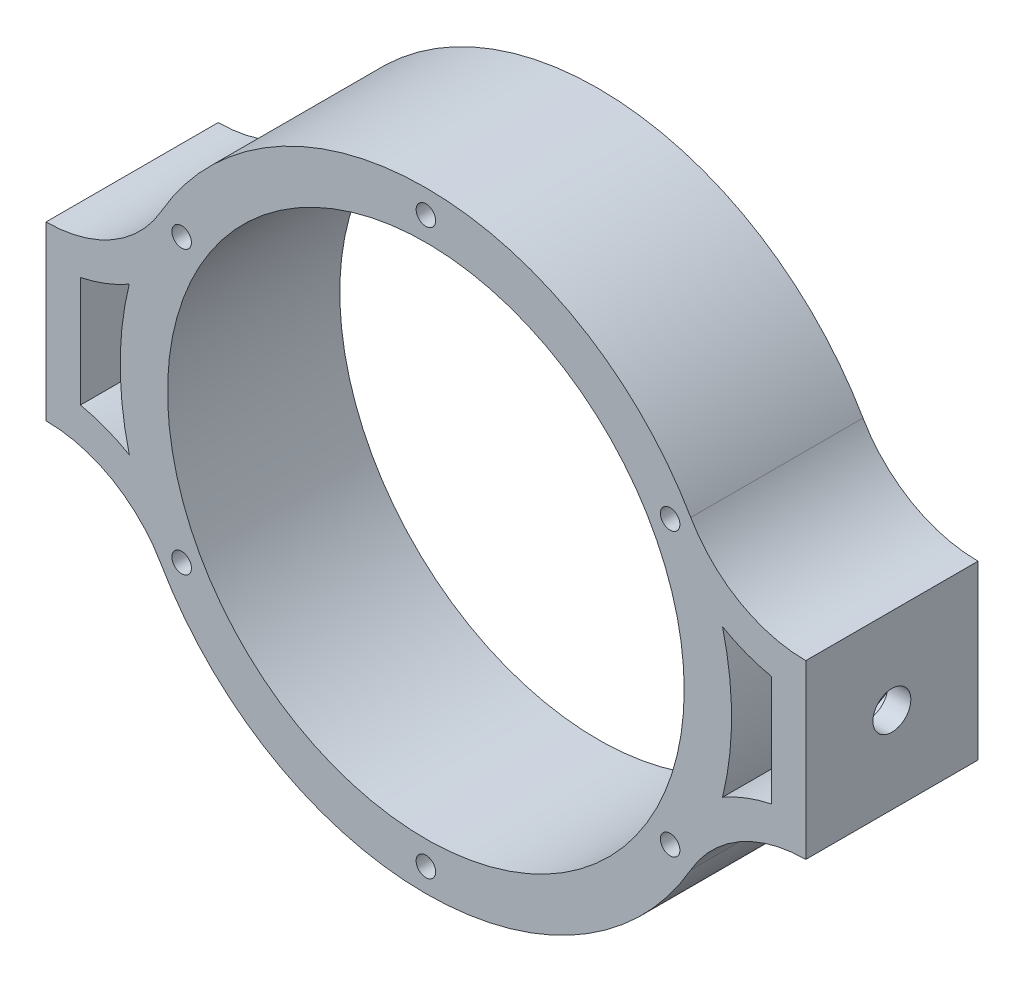
from build123d import *

# Parameters (mm, degrees)
SKETCH1_R                = 45
BOSS_EXTRUDE1_DEPTH      = 15
CUT_EXTRUDE1_DEPTH       = 91.081591488
CUT_EXTRUDE1_DEPTH_BACK  = 91.081591488
M6_CLEARANCE_HOLE1_D     = 6.6
M6_CLEARANCE_HOLE1_DEPTH = 6
M6_CLEARANCE_HOLE1_TIP   = 1.982840043
M6_CLEARANCE_HOLE2_D     = 6.6
M6_CLEARANCE_HOLE2_DEPTH = 6
M6_CLEARANCE_HOLE2_TIP   = 1.982840043
M3_CLEARANCE_HOLE1_D     = 3.4
CIRPATTERN1_COUNT        = 6
CUT_EXTRUDE2_DEPTH       = 2


with BuildPart() as part:
    # Sketch1 → Boss-Extrude1 (new, symmetric)
    with BuildSketch(Plane.XY):
        with BuildLine():
            Line((-66.175, -15), (-66.175, 15))
            ThreePointArc((-66.175, 15), (-54.605786302, 18.103041727), (-46.142284003, 26.579167161))
            ThreePointArc((-46.142284003, 26.579167161), (0, 53.25), (46.142284003, 26.579167161))
            ThreePointArc((46.142284003, 26.579167161), (54.605786302, 18.103041727), (66.175, 15))
            Line((66.175, 15), (66.175, -15))
            ThreePointArc((66.175, -15), (54.605786302, -18.103041727), (46.142284003, -26.579167161))
            ThreePointArc((46.142284003, -26.579167161), (0, -53.25), (-46.142284003, -26.579167161))
            ThreePointArc((-46.142284003, -26.579167161), (-54.605786302, -18.103041727), (-66.175, -15))
        make_face()
        Circle(SKETCH1_R, mode=Mode.SUBTRACT)
    extrude(amount=BOSS_EXTRUDE1_DEPTH, both=True)

    # Sketch2 → Cut-Extrude1 (cut, two sides: drawn at the far end of the back side and taken through both)
    with BuildSketch(Plane.XY.offset(15).offset(-CUT_EXTRUDE1_DEPTH_BACK)):
        with BuildLine():
            Line((-60.175, -9.624867567), (-60.175, 9.624867567))
            ThreePointArc((-60.175, 9.624867567), (-55.795757401, 10.912645684), (-51.671575635, 12.868984861))
            ThreePointArc((-51.671575635, 12.868984861), (-53.25, 0), (-51.671575635, -12.868984861))
            ThreePointArc((-51.671575635, -12.868984861), (-55.795757401, -10.912645684), (-60.175, -9.624867567))
        make_face()
        with BuildLine():
            Line((60.175, -9.624867567), (60.175, 9.624867567))
            ThreePointArc((60.175, 9.624867567), (55.795757401, 10.912645684), (51.671575635, 12.868984861))
            ThreePointArc((51.671575635, 12.868984861), (53.25, 0), (51.671575635, -12.868984861))
            ThreePointArc((51.671575635, -12.868984861), (55.795757401, -10.912645684), (60.175, -9.624867567))
        make_face()
    extrude(amount=CUT_EXTRUDE1_DEPTH + CUT_EXTRUDE1_DEPTH_BACK, mode=Mode.SUBTRACT)

    # M6 Clearance Hole1
    with Locations(Plane.ZY.offset(66.175)):
        with Locations((0, 0)):
            Hole(M6_CLEARANCE_HOLE1_D / 2, depth=M6_CLEARANCE_HOLE1_DEPTH)
            with Locations((0, 0, -(M6_CLEARANCE_HOLE1_DEPTH + M6_CLEARANCE_HOLE1_TIP / 2))):  # 118° drill point
                Cone(0, M6_CLEARANCE_HOLE1_D / 2, M6_CLEARANCE_HOLE1_TIP, mode=Mode.SUBTRACT)

    # M6 Clearance Hole2
    with Locations(Plane(origin=(66.175, 0, 0), x_dir=(0, 0, -1), z_dir=(1, 0, 0))):
        with Locations((0, 0)):
            Hole(M6_CLEARANCE_HOLE2_D / 2, depth=M6_CLEARANCE_HOLE2_DEPTH)
            with Locations((0, 0, -(M6_CLEARANCE_HOLE2_DEPTH + M6_CLEARANCE_HOLE2_TIP / 2))):  # 118° drill point
                Cone(0, M6_CLEARANCE_HOLE2_D / 2, M6_CLEARANCE_HOLE2_TIP, mode=Mode.SUBTRACT)

    # M3 Clearance Hole1 (through all)
    with Locations(Plane.XY.offset(15)):
        with Locations((0, 49.125)):
            m3_clearance_hole1 = Hole(M3_CLEARANCE_HOLE1_D / 2)

    # CirPattern1: M3 Clearance Hole1 ×6 about axis
    cirpattern1_axis = Axis((0, 0, 0), (0, 0, 1))
    for i in range(1, CIRPATTERN1_COUNT):
        add(m3_clearance_hole1.rotate(cirpattern1_axis, i * 360 / CIRPATTERN1_COUNT), mode=Mode.SUBTRACT)

    # Sketch9 → Cut-Extrude2 (cut)
    with BuildSketch(Plane(origin=(-60.175, 0, 0), x_dir=(0, 0, -1), z_dir=(1, 0, 0))):
        Polygon((0, 5.888972746), (-5.1, 2.944486373), (-5.1, -2.944486373), (0, -5.888972746), (5.1, -2.944486373), (5.1, 2.944486373), align=None)
    cut_extrude2 = extrude(amount=-CUT_EXTRUDE2_DEPTH, mode=Mode.SUBTRACT)

    # Mirror1: Cut-Extrude2 across plane
    add(cut_extrude2.mirror(Plane(origin=(0, 0, 0), x_dir=(0, 0, 1), z_dir=(1, 0, 0))), mode=Mode.SUBTRACT)


solid = part.part
